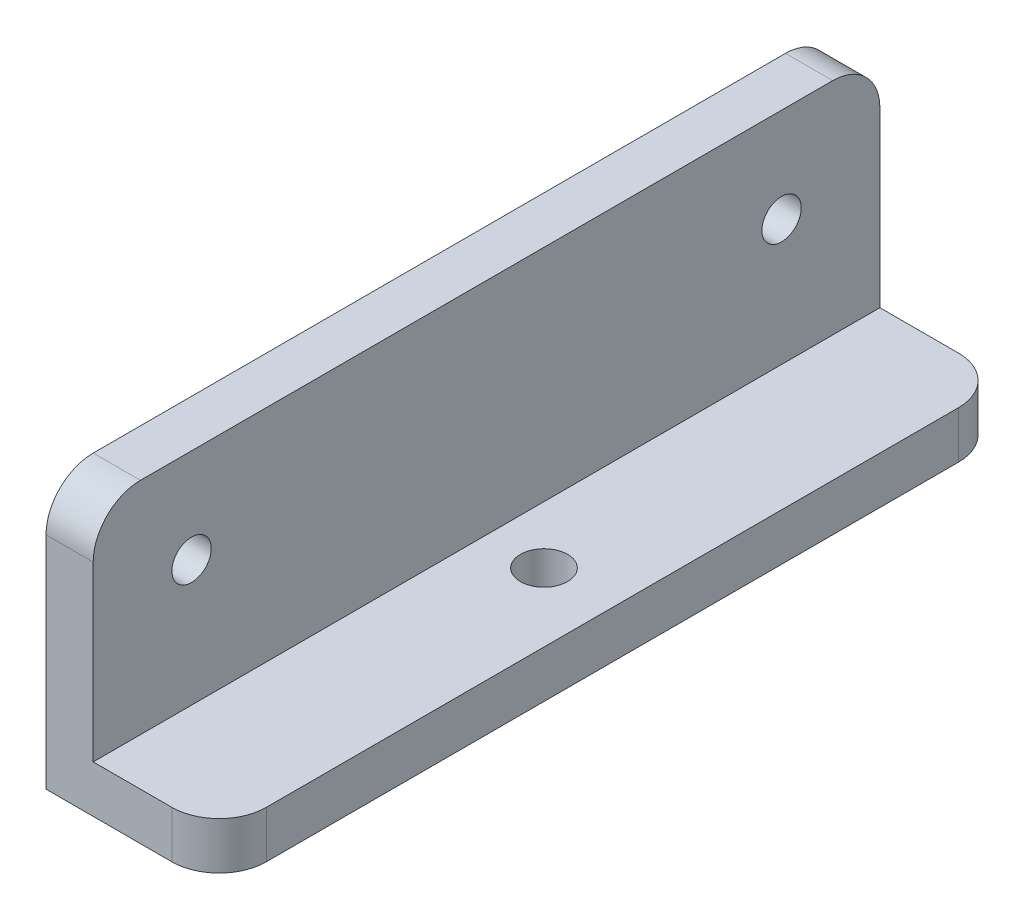
from build123d import *

# Parameters (mm, degrees)
BOSS_EXTRUDE1_DEPTH = 50
CUT_EXTRUDE1_REACH  = 64.546
SKETCH2_R           = 2.5
CUT_EXTRUDE2_REACH  = 63.384
SKETCH3_R           = 3
FILLET1_R           = 6


with BuildPart() as part:
    # Sketch1 → Boss-Extrude1 (new, symmetric)
    with BuildSketch(Plane.XY):
        Polygon((0, 34), (0, 0), (22, 0), (22, 6), (6, 6), (6, 34), align=None)
    extrude(amount=BOSS_EXTRUDE1_DEPTH, both=True)

    # Sketch2 → Cut-Extrude1 (cut, up to next)
    with BuildSketch(Plane(origin=(6, 0, 0), x_dir=(0, 0, -1), z_dir=(1, 0, 0)), mode=Mode.PRIVATE) as cut_extrude1_sk1:
        with Locations(Location((-37.5, 22, 0), (0, 0, 90))):
            Circle(SKETCH2_R)
    cut_extrude1_tool1 = extrude(cut_extrude1_sk1.sketch, amount=-CUT_EXTRUDE1_REACH, mode=Mode.PRIVATE) & part.part
    # Sketch2 → Cut-Extrude1 (cut, up to next)
    with BuildSketch(Plane(origin=(6, 0, 0), x_dir=(0, 0, -1), z_dir=(1, 0, 0)), mode=Mode.PRIVATE) as cut_extrude1_sk2:
        with Locations((37.5, 22)):
            Circle(SKETCH2_R)
    cut_extrude1_tool2 = extrude(cut_extrude1_sk2.sketch, amount=-CUT_EXTRUDE1_REACH, mode=Mode.PRIVATE) & part.part
    add(cut_extrude1_tool1.solids().sort_by_distance((6, 22, 37.5))[0], mode=Mode.SUBTRACT)
    add(cut_extrude1_tool2.solids().sort_by_distance((6, 22, -37.5))[0], mode=Mode.SUBTRACT)

    # Sketch3 → Cut-Extrude2 (cut, up to next)
    with BuildSketch(Plane(origin=(0, 6, 0), x_dir=(1, 0, 0), z_dir=(0, 1, 0)), mode=Mode.PRIVATE) as cut_extrude2_sk1:
        with Locations(Location((13.3, 0, 0), (0, 0, 180))):
            Circle(SKETCH3_R)
    cut_extrude2_tool1 = extrude(cut_extrude2_sk1.sketch, amount=-CUT_EXTRUDE2_REACH, mode=Mode.PRIVATE) & part.part
    add(cut_extrude2_tool1.solids().sort_by_distance((13.3, 6, 0))[0], mode=Mode.SUBTRACT)

    # Fillet1
    fillet1_edges = [part.edges().sort_by_distance(p)[0] for p in [
        (22, 3, 50),
        (3, 34, 50),
        (22, 3, -50),
        (3, 34, -50),
    ]]
    fillet(fillet1_edges, radius=FILLET1_R)


solid = part.part
